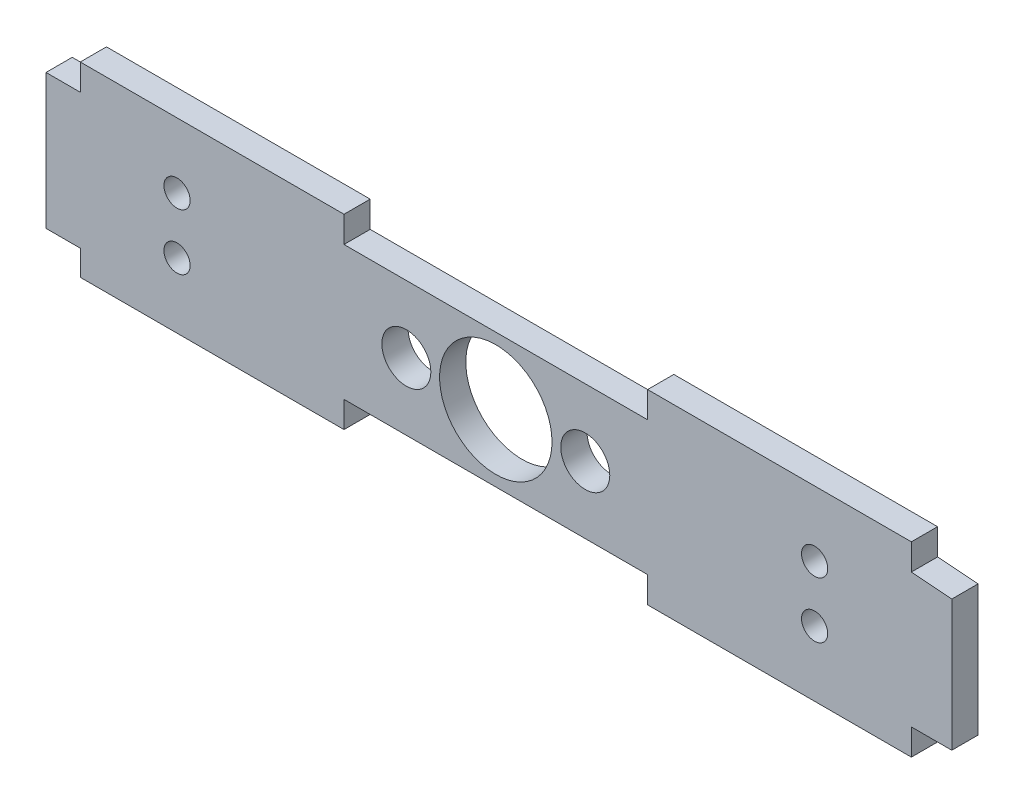
from build123d import *

# Parameters (mm, degrees)
SKETCH1_R           = 2.54
SKETCH1_R_2         = 10.898656268
SKETCH1_R_3         = 4.749956202
BOSS_EXTRUDE1_DEPTH = 5.08


with BuildPart() as part:
    # Sketch1 → Boss-Extrude1 (new body)
    with BuildSketch(Plane.XY):
        Polygon((-22.310144528, -20.706897394), (-73.443857446, -20.706897394), (-73.443857446, -25.786897394), (-80.087904918, -25.786897394), (-80.087904918, -51.975164853), (-73.443857446, -51.975164853), (-73.442970039, -56.866897394), (-22.309257121, -56.866897394), (-22.309257121, -51.786897394), (36.560767605, -51.786897394), (36.560767605, -56.866897394), (87.694480523, -56.866897394), (87.694480523, -51.786897394), (95.535685575, -51.786897394), (95.535685575, -26.395813478), (87.693593116, -25.786897394), (87.693593116, -20.706897394), (36.559880198, -20.706897394), (36.559880198, -25.786897394), (-22.310144528, -25.786897394), align=None)
        with Locations((-54.686464291, -44.236903978)):
            Circle(SKETCH1_R, mode=Mode.SUBTRACT)
        with Locations((7.124867835, -38.786897394)):
            Circle(SKETCH1_R_2, mode=Mode.SUBTRACT)
        with Locations((68.93619996, -44.236903978)):
            Circle(SKETCH1_R, mode=Mode.SUBTRACT)
        with Locations((-54.686464291, -33.336890811)):
            Circle(SKETCH1_R, mode=Mode.SUBTRACT)
        with Locations((-10.221413257, -38.786897394)):
            Circle(SKETCH1_R_3, mode=Mode.SUBTRACT)
        with Locations((24.471148926, -38.786897394)):
            Circle(SKETCH1_R_3, mode=Mode.SUBTRACT)
        with Locations((68.93619996, -33.336890811)):
            Circle(SKETCH1_R, mode=Mode.SUBTRACT)
    extrude(amount=BOSS_EXTRUDE1_DEPTH)


solid = part.part
